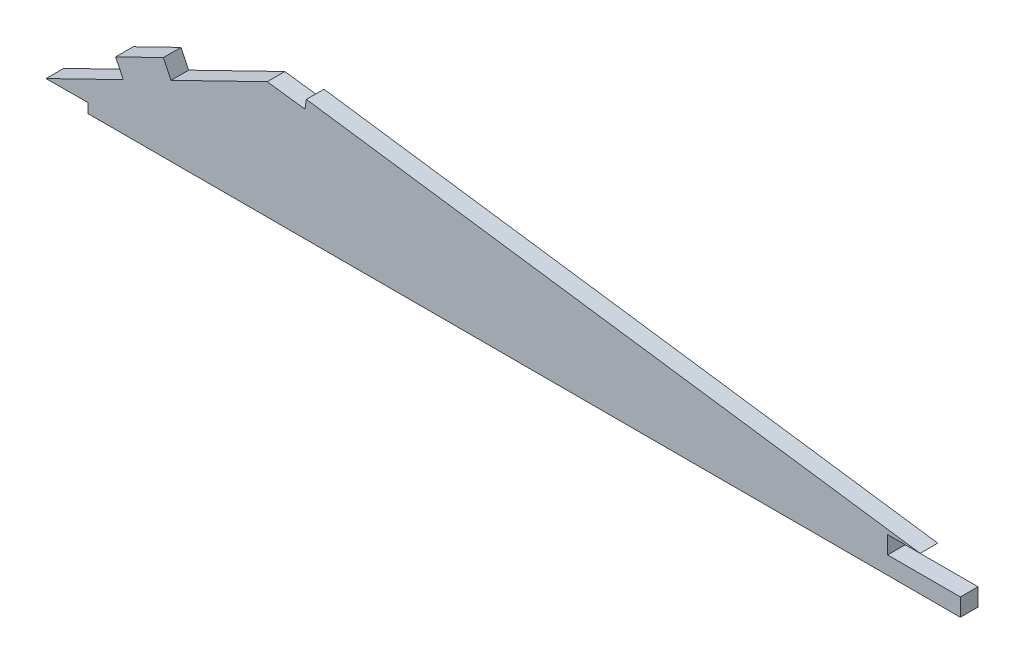
from build123d import *

# Parameters (mm, degrees)
EXTRUDE_1_DEPTH = 2


with BuildPart() as part:
    # Model → 凸台-拉伸1 (new body)
    with BuildSketch(Plane.XY):
        Polygon((16.721287408, 12.822312416), (27.628872828, 18.142297288), (31.923098451, 17.586845854), (32.071308504, 18.624538111), (101.722874852, 8.835648838), (98.03543388, 8.835648838), (98.03543388, 6.835648838), (106.291610276, 6.835648838), (106.291610276, 4.835648838), (7.314639322, 4.835648838), (7.310435698, 5.918812931), (2.5289699, 5.90025666), (11.302637862, 10.179460446), (10.425895568, 11.977048539), (15.844545115, 14.619900509), align=None)
    extrude(amount=EXTRUDE_1_DEPTH)


solid = part.part
